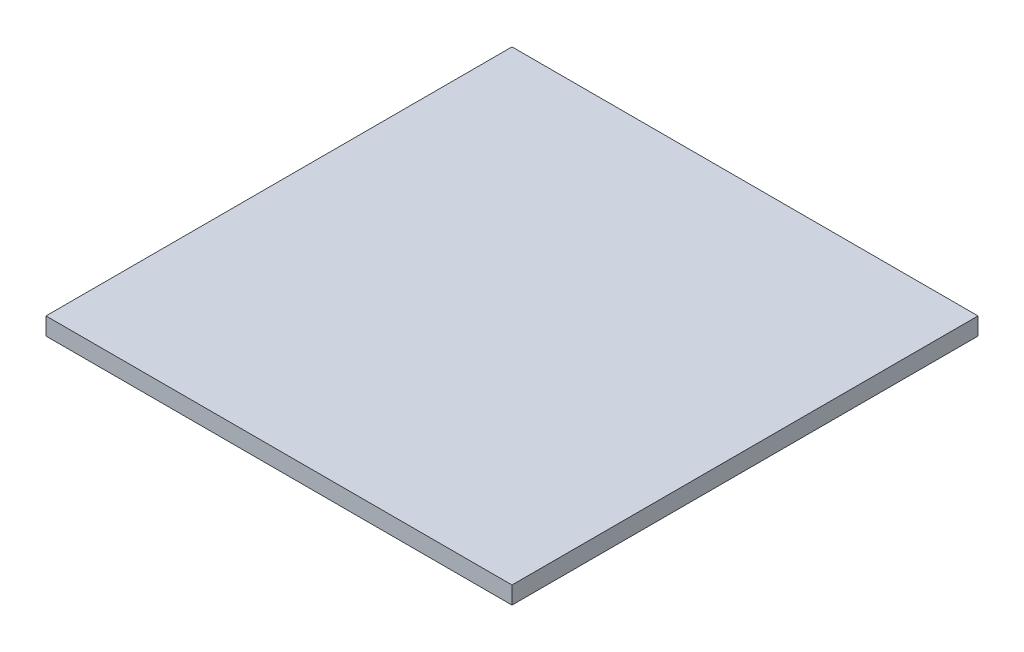
from build123d import *

# Parameters (mm, degrees)
SKETCH_1_W      = 80
SKETCH_1_H      = 80
EXTRUDE_1_DEPTH = 3


with BuildPart() as part:
    # 草图1 → 凸台-拉伸1 (new body)
    with BuildSketch(Plane(origin=(0, 0, 0), x_dir=(1, 0, 0), z_dir=(0, 1, 0))):
        Rectangle(SKETCH_1_W, SKETCH_1_H)
    extrude(amount=EXTRUDE_1_DEPTH)


solid = part.part
